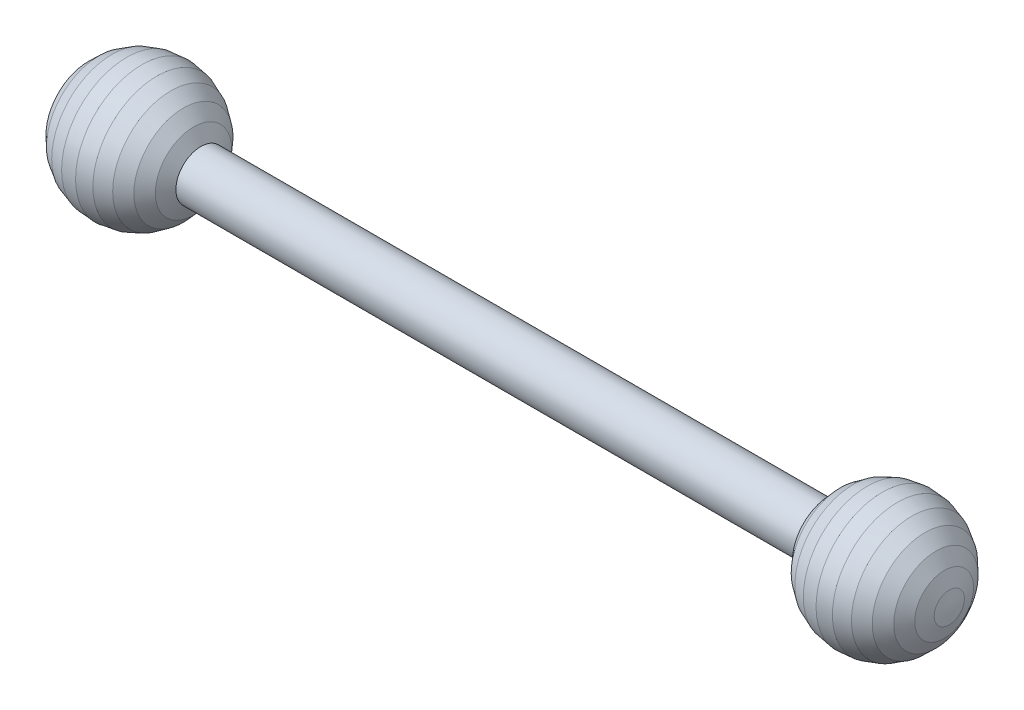
from build123d import *


with BuildPart() as part:
    # Pushrod Sketch → Pushrod (revolve)
    with BuildSketch(Plane.XY):
        Polygon((-4, 0), (-3.894878566, 0.910999976), (-3.585039521, 1.774117141), (-3.086768229, 2.543985436), (-2.426254185, 3.180140033), (-1.638214481, 3.649144189), (-0.76406905, 3.92634671), (0.150236399, 3.997177632), (1.056645315, 3.857914032), (1.907516195, 3.515875704), (2.658126657, 2.989040428), (3.269024075, 2.305099043), (3.708099244, 1.5), (41.272452109, 1.5), (41.711527278, 2.305099043), (42.322424696, 2.989040428), (43.073035158, 3.515875704), (43.923906038, 3.857914032), (44.830314954, 3.997177632), (45.744620403, 3.92634671), (46.618765834, 3.649144189), (47.406805538, 3.180140033), (48.067319582, 2.543985436), (48.565590874, 1.774117141), (48.875429919, 0.910999976), (48.980551353, 0), align=None)
    revolve(axis=Axis((-1000, 0, 0), (1, 0, 0)))


solid = part.part
